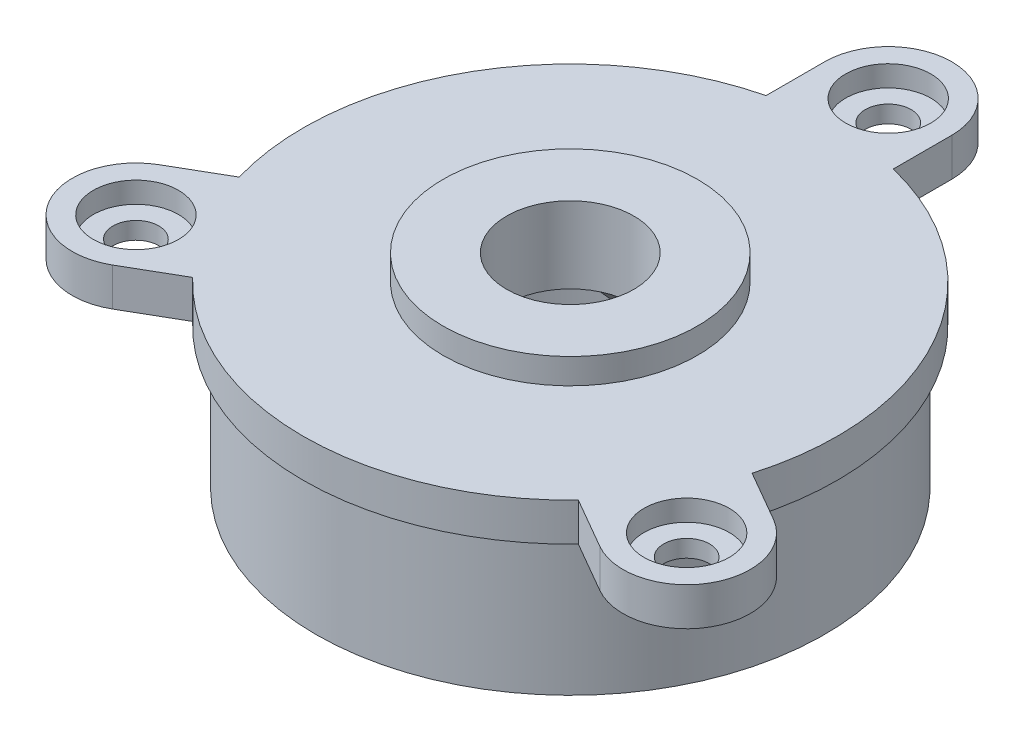
from build123d import *
from build123d.topology import SkipClean

# Parameters (mm, degrees)
SKETCH2_R                                = 10
SKETCH2_R_2                              = 5
BOSS_EXTRUDE1_DEPTH                      = 2
BOSS_EXTRUDE2_START                      = -3
SKETCH2_3_R                              = 5
BOSS_EXTRUDE2_DEPTH                      = 3
BOSS_EXTRUDE3_START                      = -4
SKETCH2_4_R                              = 6
SKETCH2_4_R_2                            = 5
BOSS_EXTRUDE3_DEPTH                      = 4
SKETCH2_6_R                              = 20
SKETCH2_6_R_2                            = 17
BOSS_EXTRUDE4_DEPTH                      = 14
CBORE_FOR_M12_HEX_HEAD_BOLT1_D           = 3.6
CBORE_FOR_M12_HEX_HEAD_BOLT1_CBORE_D     = 6.7
CBORE_FOR_M12_HEX_HEAD_BOLT1_CBORE_DEPTH = 1.65
CIRPATTERN1_COUNT                        = 3
RIB1_REACH                               = 44.5
SKETCH4_WALL_W                           = 101.866218182
SKETCH4_WALL_H                           = 2
CIRPATTERN2_COUNT                        = 6


with BuildPart() as part:
    # Sketch2 → Boss-Extrude1 (new body)
    with BuildSketch(Plane(origin=(0, 0, 0), x_dir=(1, 0, 0), z_dir=(0, 1, 0))):
        Circle(SKETCH2_R)
        Circle(SKETCH2_R_2, mode=Mode.SUBTRACT)
    extrude(amount=BOSS_EXTRUDE1_DEPTH)

    # Sketch2<3> → Boss-Extrude2 (add)
    with BuildSketch(Plane(origin=(0, 0, 0), x_dir=(1, 0, 0), z_dir=(0, 1, 0)).offset(BOSS_EXTRUDE2_START)):
        with BuildLine():
            Line((5, 20.396078054), (5, 25))
            ThreePointArc((5, 25), (0, 30), (-5, 25))
            Line((-5, 25), (-5, 20.396078054))
            ThreePointArc((-5, 20.396078054), (-18.186533479, 10.5), (-20.163521733, -5.867912008))
            Line((-20.163521733, -5.867912008), (-24.150635095, -8.169872981))
            ThreePointArc((-24.150635095, -8.169872981), (-25.980762114, -15), (-19.150635095, -16.830127019))
            Line((-19.150635095, -16.830127019), (-15.163521733, -14.528166046))
            ThreePointArc((-15.163521733, -14.528166046), (0, -21), (15.163521733, -14.528166046))
            Line((15.163521733, -14.528166046), (19.150635095, -16.830127019))
            ThreePointArc((19.150635095, -16.830127019), (25.980762114, -15), (24.150635095, -8.169872981))
            Line((24.150635095, -8.169872981), (20.163521733, -5.867912008))
            ThreePointArc((20.163521733, -5.867912008), (18.186533479, 10.5), (5, 20.396078054))
        make_face()
        Circle(SKETCH2_3_R, mode=Mode.SUBTRACT)
    extrude(amount=BOSS_EXTRUDE2_DEPTH)

    # Sketch2<4> → Boss-Extrude3 (add)
    with BuildSketch(Plane(origin=(0, 0, 0), x_dir=(1, 0, 0), z_dir=(0, 1, 0)).offset(BOSS_EXTRUDE3_START)):
        Circle(SKETCH2_4_R)
        Circle(SKETCH2_4_R_2, mode=Mode.SUBTRACT)
    extrude(amount=BOSS_EXTRUDE3_DEPTH)

    # Sketch2<6> → Boss-Extrude4 (add)
    with BuildSketch(Plane(origin=(0, 0, 0), x_dir=(1, 0, 0), z_dir=(0, 1, 0))):
        Circle(SKETCH2_6_R)
        Circle(SKETCH2_6_R_2, mode=Mode.SUBTRACT)
    extrude(amount=-BOSS_EXTRUDE4_DEPTH)

    # CBORE for M12 Hex Head Bolt1 (through all)
    with Locations(Plane(origin=(0, 0, -25), x_dir=(0, 0, 1), z_dir=(0, 1, 0))):
        with Locations((0, 0)):
            cbore_for_m12_hex_head_bolt1 = CounterBoreHole(CBORE_FOR_M12_HEX_HEAD_BOLT1_D / 2, CBORE_FOR_M12_HEX_HEAD_BOLT1_CBORE_D / 2, CBORE_FOR_M12_HEX_HEAD_BOLT1_CBORE_DEPTH)

    # CirPattern1: CBORE for M12 Hex Head Bolt1 ×3 about axis
    cirpattern1_axis = Axis((0, 0, 0), (0, 1, 0))
    for i in range(1, CIRPATTERN1_COUNT):
        add(cbore_for_m12_hex_head_bolt1.rotate(cirpattern1_axis, i * 360 / CIRPATTERN1_COUNT), mode=Mode.SUBTRACT)

    # Sketch4 wall → Rib1 (add, up to next)
    with BuildSketch(Plane(origin=(-11.5, -9, 0), x_dir=(0.739940073396, 0.672672793996, 0), z_dir=(-0.672672793996, 0.739940073396, 0)), mode=Mode.PRIVATE) as rib1_sk1:
        Rectangle(SKETCH4_WALL_W, SKETCH4_WALL_H)
    rib1_tool1 = extrude(rib1_sk1.sketch, amount=RIB1_REACH, mode=Mode.PRIVATE) - part.part
    rib1 = rib1_tool1.solids().sort_by_distance((-11.5, -9, 0))[0]
    add(rib1)

    # CirPattern2: Rib1 ×6 about axis
    with SkipClean():  # the faces are left unmerged after this step: merging them gives an invalid solid
        cirpattern2_axis = Axis((0, -14, 0), (0, 1, 0))
        for i in range(1, CIRPATTERN2_COUNT):
            add(rib1.rotate(cirpattern2_axis, i * 360 / CIRPATTERN2_COUNT))


solid = part.part
